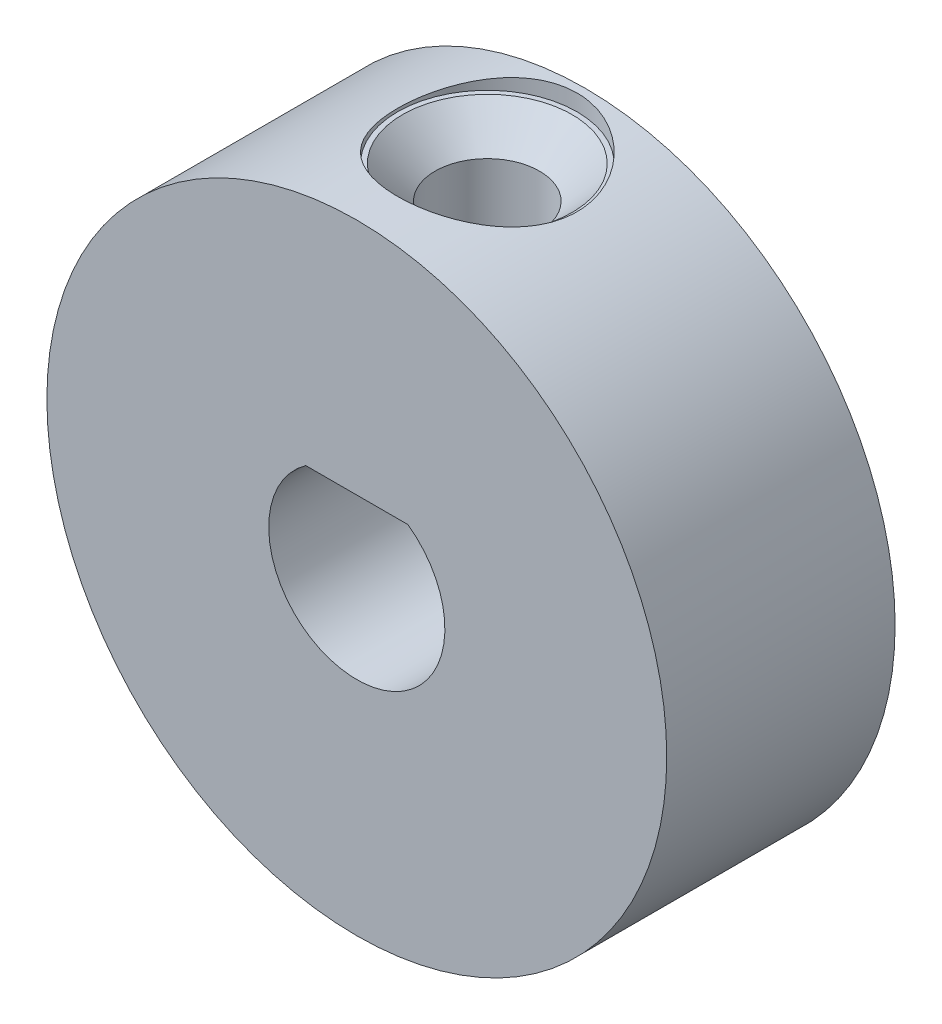
from build123d import *

# Parameters (mm, degrees)
ESQUISSE1_R                         = 9.5
BOSS_EXTRU_1_DEPTH                  = 7
ESQUISSE2_W                         = 5.5
ESQUISSE2_H                         = 2.2
ENL_V_MAT_EXTRU_1_DEPTH             = 6
ENL_V_MAT_EXTRU_2_REACH             = 19.336
ESQUISSE3_R                         = 1.6
ENL_V_MAT_EXTRU_2_DIRECTION_2_REACH = 19.336
ESQUISSE7_R                         = 2.75
ENL_V_MAT_EXTRU_4_DEPTH             = 22.943108417
CHANFREIN2_SIZE                     = 1


with BuildPart() as part:
    # Esquisse1 → Boss.-Extru.1 (new body)
    with BuildSketch(Plane.XY):
        Circle(ESQUISSE1_R)
        with BuildLine():
            Line((-1.565247584, 2.2), (1.565247584, 2.2))
            ThreePointArc((1.565247584, 2.2), (0, -2.7), (-1.565247584, 2.2))
        make_face(mode=Mode.SUBTRACT)
    extrude(amount=BOSS_EXTRU_1_DEPTH)

    # Esquisse2 → Enlèv. mat.-Extru.1 (cut)
    with BuildSketch(Plane(origin=(0, 0, 0), x_dir=(-1, 0, 0), z_dir=(0, 0, -1))):
        with Locations((0, 4.3)):
            Rectangle(ESQUISSE2_W, ESQUISSE2_H)
    extrude(amount=-ENL_V_MAT_EXTRU_1_DEPTH, mode=Mode.SUBTRACT)

    # Esquisse3 → Enlèv. mat.-Extru.2 (cut, up to next)
    with BuildSketch(Plane(origin=(0, 3.2, 0), x_dir=(1, 0, 0), z_dir=(0, 1, 0)), mode=Mode.PRIVATE) as enl_v_mat_extru_2_sk1:
        with Locations(Location((0, -3, 0), (0, 0, 90))):
            Circle(ESQUISSE3_R)
    enl_v_mat_extru_2_tool1 = extrude(enl_v_mat_extru_2_sk1.sketch, amount=-ENL_V_MAT_EXTRU_2_REACH, mode=Mode.PRIVATE) & part.part
    add(enl_v_mat_extru_2_tool1.solids().sort_by_distance((0, 3.2, 3))[0], mode=Mode.SUBTRACT)

    # Esquisse3 → Enlèv. mat.-Extru.2 direction 2 (cut, up to next)
    with BuildSketch(Plane(origin=(0, 3.2, 0), x_dir=(1, 0, 0), z_dir=(0, 1, 0)), mode=Mode.PRIVATE) as enl_v_mat_extru_2_direction_2_sk1:
        with Locations(Location((0, -3, 0), (0, 0, 90))):
            Circle(ESQUISSE3_R)
    enl_v_mat_extru_2_direction_2_tool1 = extrude(enl_v_mat_extru_2_direction_2_sk1.sketch, amount=ENL_V_MAT_EXTRU_2_DIRECTION_2_REACH, mode=Mode.PRIVATE) & part.part
    add(enl_v_mat_extru_2_direction_2_tool1.solids().sort_by_distance((0, 3.2, 3))[0], mode=Mode.SUBTRACT)

    # Esquisse7 → Enlèv. mat.-Extru.4 (cut, through all)
    with BuildSketch(Plane(origin=(0, 9, 0), x_dir=(1, 0, 0), z_dir=(0, 1, 0))):
        with Locations(Location((0, -3, 0), (0, 0, 90))):
            Circle(ESQUISSE7_R)
    extrude(amount=ENL_V_MAT_EXTRU_4_DEPTH, mode=Mode.SUBTRACT)

    # Chanfrein2
    chanfrein2_edges = [part.edges().sort_by_distance(p)[0] for p in [
        (0, 9, 4.6),
    ]]
    chamfer(chanfrein2_edges, length=CHANFREIN2_SIZE)


solid = part.part
